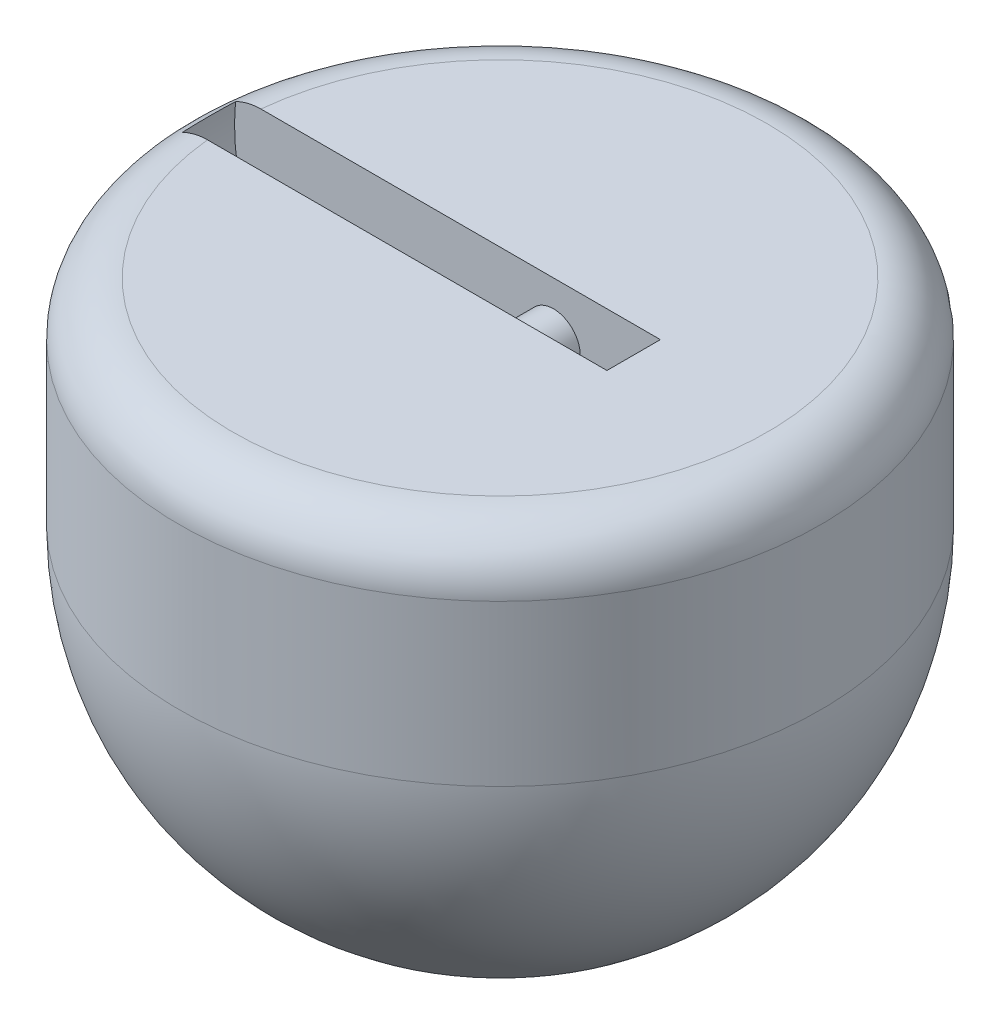
from build123d import *

# Parameters (mm, degrees)
CUT_EXTRUDE_2_DEPTH = 1
SKETCH_3_R          = 1
EXTRUDE_2_DEPTH     = 2


with BuildPart() as part:
    # 草图1 → 旋转1 (revolve)
    with BuildSketch(Plane.XY, mode=Mode.PRIVATE) as revolve_1_sk:
        with BuildLine():
            Line((0, 6.040955631), (10, 6.040955631))
            ThreePointArc((10, 6.040955631), (11.414213562, 5.455169194), (12, 4.040955631))
            Line((12, 4.040955631), (12, -1.959044369))
            ThreePointArc((12, -1.959044369), (8.485281374, -10.444325743), (0, -13.959044369))
            Line((0, -13.959044369), (0, 6.040955631))
        make_face()
    revolve(revolve_1_sk.sketch.rotate(Axis((0, -13.959044369, 0), (0, 1, 0)), 90), axis=Axis((0, -13.959044369, 0), (0, 1, 0)))

    # 草图2 → 切除-拉伸2 (cut, symmetric)
    with BuildSketch(Plane.XY):
        with BuildLine():
            Line((5, 6.040955631), (-10, 6.040955631))
            ThreePointArc((-10, 6.040955631), (-10.461704233, 5.986933329), (-10.89846614, 5.827784833))
            ThreePointArc((-10.89846614, 5.827784833), (-2.829997478, -2.95832534), (5, 6.040955631))
        make_face()
    extrude(amount=CUT_EXTRUDE_2_DEPTH, both=True, mode=Mode.SUBTRACT)

    # 草图3 → 凸台-拉伸2 (add)
    with BuildSketch(Plane.XY.offset(-1)):
        with Locations(Location((-3, 1.040955631, 0), (0, 0, 180))):
            Circle(SKETCH_3_R)
        with Locations(Location((1, 4.040955631, 0), (0, 0, 180))):
            Circle(SKETCH_3_R)
    extrude(amount=EXTRUDE_2_DEPTH)


solid = part.part
